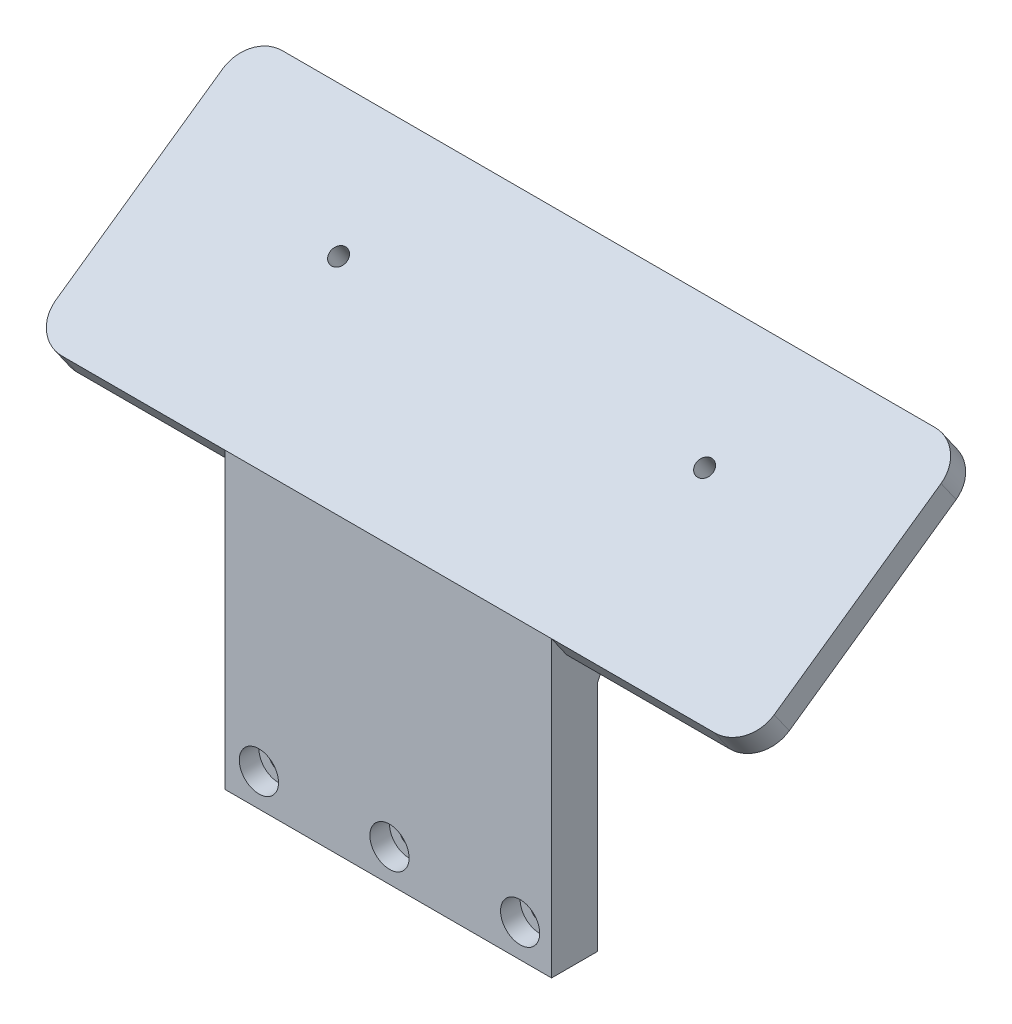
from build123d import *

# Parameters (mm, degrees)
SKETCH_1_W          = 50
SKETCH_1_H          = 7
EXTRUDE_1_DEPTH     = 45
SKETCH_2_R          = 3
CUT_EXTRUDE_1_DEPTH = 3
SKETCH_3_R          = 1.4
CUT_EXTRUDE_2_DEPTH = 83.08499944
SKETCH_5_R          = 1.3
EXTRUDE_2_DEPTH     = 4.015035
EXTRUDE_3_DEPTH     = 50
FILLET_1_R          = 5


with BuildPart() as part:
    # 草图1 → 凸台-拉伸1 (new body)
    with BuildSketch(Plane(origin=(0, 0, 0), x_dir=(1, 0, 0), z_dir=(0, 1, 0))):
        with Locations((-43.534277066, -15.400769649)):
            Rectangle(SKETCH_1_W, SKETCH_1_H)
    extrude(amount=EXTRUDE_1_DEPTH)

    # 草图2 → 切除-拉伸1 (cut)
    with BuildSketch(Plane.XY.offset(18.900769649)):
        with Locations((-43.350176606, 5)):
            Circle(SKETCH_2_R)
        with Locations((-23.350176606, 5)):
            Circle(SKETCH_2_R)
        with Locations((-63.350176606, 5)):
            Circle(SKETCH_2_R)
    extrude(amount=-CUT_EXTRUDE_1_DEPTH, mode=Mode.SUBTRACT)

    # 草图3 → 切除-拉伸2 (cut, through all)
    with BuildSketch(Plane.XY.offset(15.900769649)):
        with Locations((-23.350176606, 5)):
            Circle(SKETCH_3_R)
        with Locations((-43.350176606, 5)):
            Circle(SKETCH_3_R)
        with Locations((-63.350176606, 5)):
            Circle(SKETCH_3_R)
    extrude(amount=-CUT_EXTRUDE_2_DEPTH, mode=Mode.SUBTRACT)

    # 草图5 → 凸台-拉伸2 (add)
    with BuildSketch(Plane(origin=(0, 39.075910108, 27.36124682), x_dir=(1, 0, 0), z_dir=(0, 0.819152044288991, 0.5735764363510473))):
        Polygon((-68.534277066, 10.328335539), (-18.534277066, 10.328335539), (11.465722934, 10.328335539), (11.465722934, 51.520032107), (-18.534277066, 51.520032107), (-68.534277066, 51.520032107), (-98.534277066, 51.520032107), (-98.534277066, 10.328335539), align=None)
        with Locations(Location((-71.375176606, 35.020032107, 0), (0, 0, 270))):
            Circle(SKETCH_5_R, mode=Mode.SUBTRACT)
        with Locations(Location((-15.325176606, 35.020032107, 0), (0, 0, 270))):
            Circle(SKETCH_5_R, mode=Mode.SUBTRACT)
    extrude(amount=-EXTRUDE_2_DEPTH)

    # 草图6 → 凸台-拉伸3 (add)
    with BuildSketch(Plane(origin=(-18.534277066, 0, 0), x_dir=(0, 0, -1), z_dir=(1, 0, 0))):
        Polygon((-11.900769649, 45), (-5.610910777, 49.404206597), (-11.900769649, 35.535742762), align=None)
    extrude(amount=-EXTRUDE_3_DEPTH)

    # 圆角1
    fillet_1_edges = [part.edges().sort_by_distance(p)[0] for p in [
        (11.465722934, 43.355537936, 17.749304916),
        (-98.534277066, 66.982124461, -15.992957536),
        (11.465722934, 66.982124461, -15.992957536),
        (-98.534277066, 43.355537936, 17.749304916),
    ]]
    fillet(fillet_1_edges, radius=FILLET_1_R)


solid = part.part
